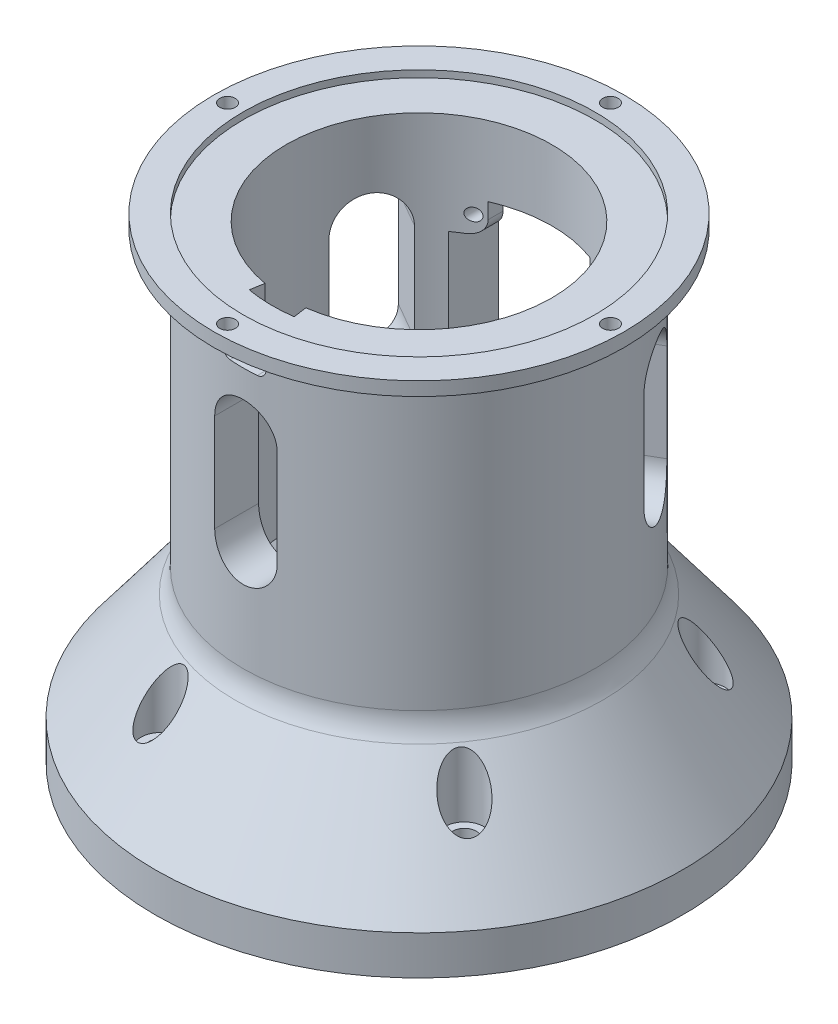
from build123d import *

# Parameters (mm, degrees)
SKETCH1_R           = 67.5
SKETCH2_R           = 45
SKETCH4_R           = 3
CUT_EXTRUDE2_DEPTH  = 101.062480646
SKETCH5_R           = 5
SKETCH5_R_2         = 3
CUT_EXTRUDE3_DEPTH  = 20
SKETCH6_R           = 45
BOSS_EXTRUDE1_DEPTH = 80
FILLET1_R           = 10
SKETCH12_R          = 67.5
BOSS_EXTRUDE2_DEPTH = 10
CUT_EXTRUDE5_START  = -20
SKETCH15_R          = 3
CUT_EXTRUDE5_DEPTH  = 20
CUT_EXTRUDE6_DEPTH  = 50
CIRPATTERN1_COUNT   = 3
CUT_EXTRUDE7_DEPTH  = 50
SKETCH22_W          = 40
SKETCH22_H          = 40
CUT_EXTRUDE8_DEPTH  = 25
SKETCH23_R          = 1.6
CUT_EXTRUDE9_DEPTH  = 36
CUT_EXTRUDE12_DEPTH = 70
CUT_EXTRUDE14_START = -6
CUT_EXTRUDE14_DEPTH = 6
SKETCH33_R          = 52.5
SKETCH33_R_2        = 45
BOSS_EXTRUDE3_DEPTH = 1.75
SKETCH34_R          = 2
CUT_EXTRUDE15_DEPTH = 10


with BuildPart() as part:
    # Sketch1 → Loft1 section 0
    with BuildSketch(Plane(origin=(0, 0, 0), x_dir=(1, 0, 0), z_dir=(0, 1, 0))):
        Circle(SKETCH1_R)
    # Sketch2 → Loft1 section 1
    with BuildSketch(Plane(origin=(0, 30, 0), x_dir=(1, 0, 0), z_dir=(0, 1, 0))):
        Circle(SKETCH2_R)
    loft()

    # Sketch4 → Cut-Extrude2 (cut, through all)
    with BuildSketch(Plane(origin=(0, 30, 0), x_dir=(1, 0, 0), z_dir=(0, 1, 0))):
        with Locations(Location((-52.5, 0, 0), (0, 0, 270))):
            Circle(SKETCH4_R)
        with Locations(Location((-16.223392205, 49.930467105, 0), (0, 0, 270))):
            Circle(SKETCH4_R)
        with Locations(Location((42.473392205, 30.858725745, 0), (0, 0, 270))):
            Circle(SKETCH4_R)
        with Locations(Location((42.473392205, -30.858725745, 0), (0, 0, 270))):
            Circle(SKETCH4_R)
        with Locations(Location((-16.223392205, -49.930467105, 0), (0, 0, 270))):
            Circle(SKETCH4_R)
    extrude(amount=-CUT_EXTRUDE2_DEPTH, mode=Mode.SUBTRACT)

    # Sketch5 → Cut-Extrude3 (cut)
    # profile 1 of 5: a face of its own
    with BuildSketch(Plane(origin=(0, 30, 0), x_dir=(1, 0, 0), z_dir=(0, 1, 0))):
        with Locations(Location((-52.5, 0, 0), (0, 0, 270))):
            Circle(SKETCH5_R)
        with Locations(Location((-52.5, 0, 0), (0, 0, 270))):
            Circle(SKETCH5_R_2, mode=Mode.SUBTRACT)
    # profile 2 of 5: a face of its own
    with BuildSketch(Plane(origin=(0, 30, 0), x_dir=(1, 0, 0), z_dir=(0, 1, 0))):
        with Locations(Location((-16.223392205, 49.930467105, 0), (0, 0, 270))):
            Circle(SKETCH5_R)
    # profile 3 of 5: a face of its own
    with BuildSketch(Plane(origin=(0, 30, 0), x_dir=(1, 0, 0), z_dir=(0, 1, 0))):
        with Locations(Location((42.473392205, 30.858725745, 0), (0, 0, 270))):
            Circle(SKETCH5_R)
    # profile 4 of 5: a face of its own
    with BuildSketch(Plane(origin=(0, 30, 0), x_dir=(1, 0, 0), z_dir=(0, 1, 0))):
        with Locations(Location((42.473392205, -30.858725745, 0), (0, 0, 270))):
            Circle(SKETCH5_R)
    # profile 5 of 5: a face of its own
    with BuildSketch(Plane(origin=(0, 30, 0), x_dir=(1, 0, 0), z_dir=(0, 1, 0))):
        with Locations(Location((-16.223392205, -49.930467105, 0), (0, 0, 270))):
            Circle(SKETCH5_R)
    extrude(amount=-CUT_EXTRUDE3_DEPTH, mode=Mode.SUBTRACT)

    # Sketch6 → Boss-Extrude1 (add)
    with BuildSketch(Plane(origin=(0, 30, 0), x_dir=(1, 0, 0), z_dir=(0, 1, 0))):
        with Locations(Location((0, 0, 0), (0, 0, 270))):
            Circle(SKETCH6_R)
    extrude(amount=BOSS_EXTRUDE1_DEPTH)

    # Fillet1
    fillet1_edges = [part.edges().sort_by_distance(p)[0] for p in [
        (-31.819805153, 30, -31.819805153),
    ]]
    fillet(fillet1_edges, radius=FILLET1_R)

    # Sketch11 → Cut-Revolve1 (revolve, cut)
    with BuildSketch(Plane(origin=(17.443981854, 57.544558278, 0), x_dir=(1, 0, 0), z_dir=(0, 0, 1)), mode=Mode.PRIVATE) as cut_revolve1_sk:
        Polygon((-17.443981854, 52.455441722), (-51.443981854, 52.455441722), (-51.443981854, -33.544558278), (-40.443981854, -43.785225639), (-17.443981854, -43.785225639), align=None)
    revolve(cut_revolve1_sk.sketch.rotate(Axis((0, 110, 0), (0, -1, 0)), 270), axis=Axis((0, 110, 0), (0, -1, 0)), mode=Mode.SUBTRACT)

    # Sketch12 → Boss-Extrude2 (add)
    with BuildSketch(Plane.XZ):
        with Locations(Location((0, 0, 0), (0, 0, 270))):
            Circle(SKETCH12_R)
    extrude(amount=BOSS_EXTRUDE2_DEPTH)

    # Sketch15 → Cut-Extrude5 (cut)
    with BuildSketch(Plane.XZ.offset(10).offset(CUT_EXTRUDE5_START)):
        with Locations(Location((-52.5, 0, 0), (0, 0, 90))):
            Circle(SKETCH15_R)
        with Locations(Location((42.473392205, 30.858725745, 0), (0, 0, 90))):
            Circle(SKETCH15_R)
        with Locations(Location((42.473392205, -30.858725745, 0), (0, 0, 90))):
            Circle(SKETCH15_R)
        with Locations(Location((-16.223392205, -49.930467105, 0), (0, 0, 90))):
            Circle(SKETCH15_R)
        with Locations(Location((-16.223392205, 49.930467105, 0), (0, 0, 90))):
            Circle(SKETCH15_R)
    extrude(amount=CUT_EXTRUDE5_DEPTH, mode=Mode.SUBTRACT)

    # Sketch16 → Cut-Extrude6 (cut)
    with BuildSketch(Plane.XY):
        with BuildLine():
            Line((8, 85), (8, 60))
            ThreePointArc((8, 60), (0, 52), (-8, 60))
            Line((-8, 60), (-8, 85))
            ThreePointArc((-8, 85), (0, 93), (8, 85))
        make_face()
    cut_extrude6 = extrude(amount=CUT_EXTRUDE6_DEPTH, mode=Mode.SUBTRACT)

    # CirPattern1: Cut-Extrude6 ×3 about axis
    cirpattern1_axis = Axis((0, 0, 0), (0, 1, 0))
    for i in range(1, CIRPATTERN1_COUNT):
        add(cut_extrude6.rotate(cirpattern1_axis, i * 360 / CIRPATTERN1_COUNT), mode=Mode.SUBTRACT)

    # Sketch18 → Cut-Extrude7 (cut)
    with BuildSketch(Plane.XY):
        with BuildLine():
            Line((16, 85.5), (20, 85.5))
            Line((20, 85.5), (20, 60))
            Line((20, 60), (17.5, 60))
            ThreePointArc((17.5, 60), (14.671572875, 58.828427125), (13.5, 56))
            Line((13.5, 56), (13.5, 52))
            Line((13.5, 52), (-12, 52))
            Line((-12, 52), (-12, 54.5))
            ThreePointArc((-12, 54.5), (-13.171572875, 57.328427125), (-16, 58.5))
            Line((-16, 58.5), (-20, 58.5))
            Line((-20, 58.5), (-20, 84))
            Line((-20, 84), (-17.5, 84))
            ThreePointArc((-17.5, 84), (-14.671572875, 85.171572875), (-13.5, 88))
            Line((-13.5, 88), (-13.5, 92))
            Line((-13.5, 92), (12, 92))
            Line((12, 92), (12, 89.5))
            ThreePointArc((12, 89.5), (13.171572875, 86.671572875), (16, 85.5))
        make_face()
    extrude(amount=-CUT_EXTRUDE7_DEPTH, mode=Mode.SUBTRACT)

    # Sketch22 → Cut-Extrude8 (cut)
    with BuildSketch(Plane.XY.offset(-60)):
        with Locations((0, 72.5)):
            Rectangle(SKETCH22_W, SKETCH22_H)
    extrude(amount=CUT_EXTRUDE8_DEPTH, mode=Mode.SUBTRACT)

    # Sketch23 → Cut-Extrude9 (cut)
    with BuildSketch(Plane.XY.offset(-60)):
        with Locations(Location((16, 88.5, 0), (0, 0, 180))):
            Circle(SKETCH23_R)
        with Locations(Location((-16, 88.5, 0), (0, 0, 180))):
            Circle(SKETCH23_R)
        with Locations(Location((-16, 56.5, 0), (0, 0, 180))):
            Circle(SKETCH23_R)
        with Locations(Location((16, 56.5, 0), (0, 0, 180))):
            Circle(SKETCH23_R)
    extrude(amount=CUT_EXTRUDE9_DEPTH, mode=Mode.SUBTRACT)

    # Sketch30 → Cut-Extrude12 (cut)
    with BuildSketch(Plane.XY):
        with BuildLine():
            Line((-3.5, 104), (3.5, 104))
            ThreePointArc((3.5, 104), (5.5, 102), (3.5, 100))
            Line((3.5, 100), (-3.5, 100))
            ThreePointArc((-3.5, 100), (-5.5, 102), (-3.5, 104))
        make_face()
    extrude(amount=CUT_EXTRUDE12_DEPTH, mode=Mode.SUBTRACT)

    # Sketch32 → Cut-Extrude14 (cut)
    with BuildSketch(Plane(origin=(0, 110, 0), x_dir=(1, 0, 0), z_dir=(0, 1, 0)).offset(CUT_EXTRUDE14_START)):
        with BuildLine():
            Line((4.709344153, -33.672274614), (5.19412958, -37.138538177))
            ThreePointArc((5.19412958, -37.138538177), (-0.679566126, -37.493842026), (-6.536528659, -36.92592305))
            Line((-6.536528659, -36.92592305), (-5.926452651, -33.479503565))
            ThreePointArc((-5.926452651, -33.479503565), (-0.616139954, -33.99441677), (4.709344153, -33.672274614))
        make_face()
    extrude(amount=CUT_EXTRUDE14_DEPTH, mode=Mode.SUBTRACT)

    # Sketch33 → Boss-Extrude3 (add, symmetric)
    with BuildSketch(Plane(origin=(0, 110, 0), x_dir=(1, 0, 0), z_dir=(0, 1, 0))):
        with Locations(Location((0, 0, 0), (0, 0, 270))):
            Circle(SKETCH33_R)
        with Locations(Location((0, 0, 0), (0, 0, 270))):
            Circle(SKETCH33_R_2, mode=Mode.SUBTRACT)
    extrude(amount=BOSS_EXTRUDE3_DEPTH, both=True)

    # Sketch34 → Cut-Extrude15 (cut)
    with BuildSketch(Plane(origin=(0, 111.75, 0), x_dir=(1, 0, 0), z_dir=(0, 1, 0))):
        with Locations(Location((0, 49, 0), (0, 0, 270))):
            Circle(SKETCH34_R)
        with Locations(Location((49, 0, 0), (0, 0, 270))):
            Circle(SKETCH34_R)
        with Locations(Location((0, -49, 0), (0, 0, 270))):
            Circle(SKETCH34_R)
        with Locations(Location((-49, 0, 0), (0, 0, 270))):
            Circle(SKETCH34_R)
    extrude(amount=-CUT_EXTRUDE15_DEPTH, mode=Mode.SUBTRACT)


solid = part.part
